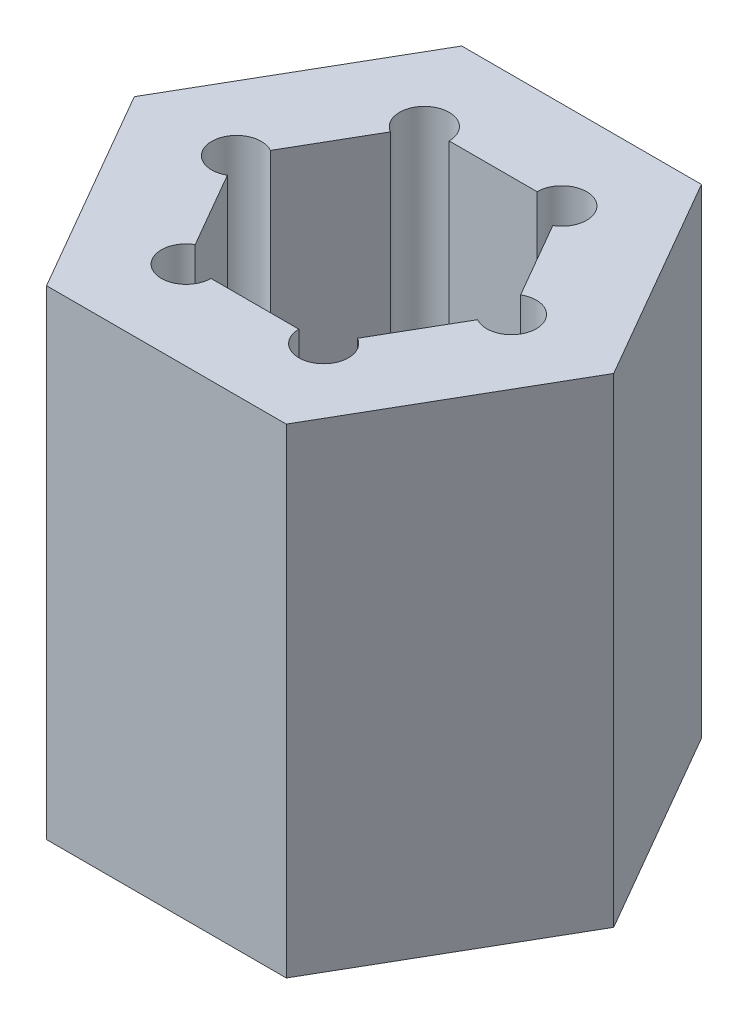
from build123d import *

# Parameters (mm, degrees)
BOSS_EXTRUDE1_DEPTH = 14.5
SKETCH2_R           = 0.75
CUT_EXTRUDE1_DEPTH  = 18.381785246


with BuildPart() as part:
    # Sketch1 → Boss-Extrude1 (new body)
    with BuildSketch(Plane(origin=(0, 0, 0), x_dir=(1, 0, 0), z_dir=(0, 1, 0))):
        Polygon((-3.622872939, 6.275), (-7.245745878, 0), (-3.622872939, -6.275), (3.622872939, -6.275), (7.245745878, 0), (3.622872939, 6.275), align=None)
        Polygon((4.156921938, 0), (2.078460969, 3.6), (-2.078460969, 3.6), (-4.156921938, 0), (-2.078460969, -3.6), (2.078460969, -3.6), align=None, mode=Mode.SUBTRACT)
    extrude(amount=BOSS_EXTRUDE1_DEPTH)

    # Sketch2 → Cut-Extrude1 (cut, through all)
    with BuildSketch(Plane(origin=(0, 14.5, 0), x_dir=(1, 0, 0), z_dir=(0, 1, 0))):
        with Locations((-2.078460969, 3.6)):
            Circle(SKETCH2_R)
        with Locations((2.078460969, 3.6)):
            Circle(SKETCH2_R)
        with Locations((4.156921938, 0)):
            Circle(SKETCH2_R)
        with Locations((2.078460969, -3.6)):
            Circle(SKETCH2_R)
        with Locations((-2.078460969, -3.6)):
            Circle(SKETCH2_R)
        with Locations((-4.156921938, 0)):
            Circle(SKETCH2_R)
    extrude(amount=-CUT_EXTRUDE1_DEPTH, mode=Mode.SUBTRACT)


solid = part.part
